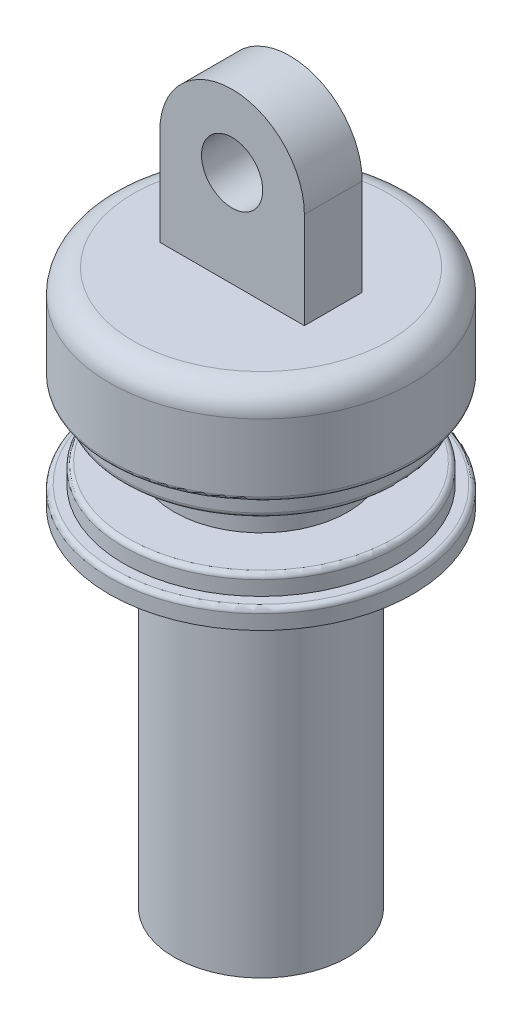
from build123d import *

# Parameters (mm, degrees)
BOSS_EXTRUDE1_DEPTH = 6
SKETCH2_R           = 31.5
BOSS_EXTRUDE2_DEPTH = 20
SKETCH3_R           = 28.5
BOSS_EXTRUDE3_DEPTH = 5
FILLET1_R           = 5
FILLET2_R           = 1
SKETCH4_R           = 6.35
CUT_EXTRUDE1_DEPTH  = 13
SKETCH5_R           = 18
BOSS_EXTRUDE4_DEPTH = 90


with BuildPart() as part:
    # Sketch1 → Boss-Extrude1 (new, symmetric)
    with BuildSketch(Plane.XY):
        with BuildLine():
            Line((-15, -20), (15, -20))
            Line((15, -20), (15, 0))
            ThreePointArc((15, 0), (0, 15), (-15, 0))
            Line((-15, 0), (-15, -20))
        make_face()
    extrude(amount=BOSS_EXTRUDE1_DEPTH, both=True)

    # Sketch2 → Boss-Extrude2 (add)
    with BuildSketch(Plane.XZ.offset(20)):
        with Locations(Location((0, 0, 0), (0, 0, 270))):
            Circle(SKETCH2_R)
    extrude(amount=BOSS_EXTRUDE2_DEPTH)

    # Sketch3 → Boss-Extrude3 (add)
    with BuildSketch(Plane.XZ.offset(40)):
        with Locations(Location((0, 0, 0), (0, 0, 270))):
            Circle(SKETCH3_R)
    extrude(amount=BOSS_EXTRUDE3_DEPTH)

    # Fillet1
    fillet1_edges = [part.edges().sort_by_distance(p)[0] for p in [
        (0, -20, 31.5),
    ]]
    fillet(fillet1_edges, radius=FILLET1_R)

    # Fillet2
    fillet2_edges = [part.edges().sort_by_distance(p)[0] for p in [
        (0, -40, 31.5),
        (0, -40, 28.5),
        (0, -45, 28.5),
    ]]
    fillet(fillet2_edges, radius=FILLET2_R)

    # Sketch4 → Cut-Extrude1 (cut)
    with BuildSketch(Plane.XY.offset(6)):
        Circle(SKETCH4_R)
    extrude(amount=-CUT_EXTRUDE1_DEPTH, mode=Mode.SUBTRACT)

    # Sketch5 → Boss-Extrude4 (add)
    with BuildSketch(Plane.XZ.offset(45)):
        with Locations(Location((0, 0, 0), (0, 0, 90))):
            Circle(SKETCH5_R)
    extrude(amount=BOSS_EXTRUDE4_DEPTH)

    # Sketch7 → Cut-Revolve1 (revolve, cut)
    with BuildSketch(Plane(origin=(0, 0, 0), x_dir=(0, 0, -1), z_dir=(1, 0, 0))):
        Polygon((0, -135), (-6, -135), (-6, -130), (-13, -130), (-13, -49), (0, -49), align=None)
    revolve(axis=Axis((0, 0, 0), (0, -1, 0)), mode=Mode.SUBTRACT)

    # Sketch8 → Revolve1 (revolve)
    with BuildSketch(Plane(origin=(0, 0, 0), x_dir=(0, 0, -1), z_dir=(1, 0, 0))):
        with BuildLine():
            Line((-18, -55), (-27.5, -55))
            ThreePointArc((-27.5, -55), (-28.207106781, -55.292893219), (-28.5, -56))
            Line((-28.5, -56), (-28.5, -59))
            Line((-28.5, -59), (-30.5, -59))
            ThreePointArc((-30.5, -59), (-31.207106781, -59.292893219), (-31.5, -60))
            Line((-31.5, -60), (-31.5, -63))
            Line((-31.5, -63), (-18, -63))
            Line((-18, -63), (-18, -55))
        make_face()
    revolve(axis=Axis((0, -49.566737635, 0), (0, -1, 0)))


solid = part.part
